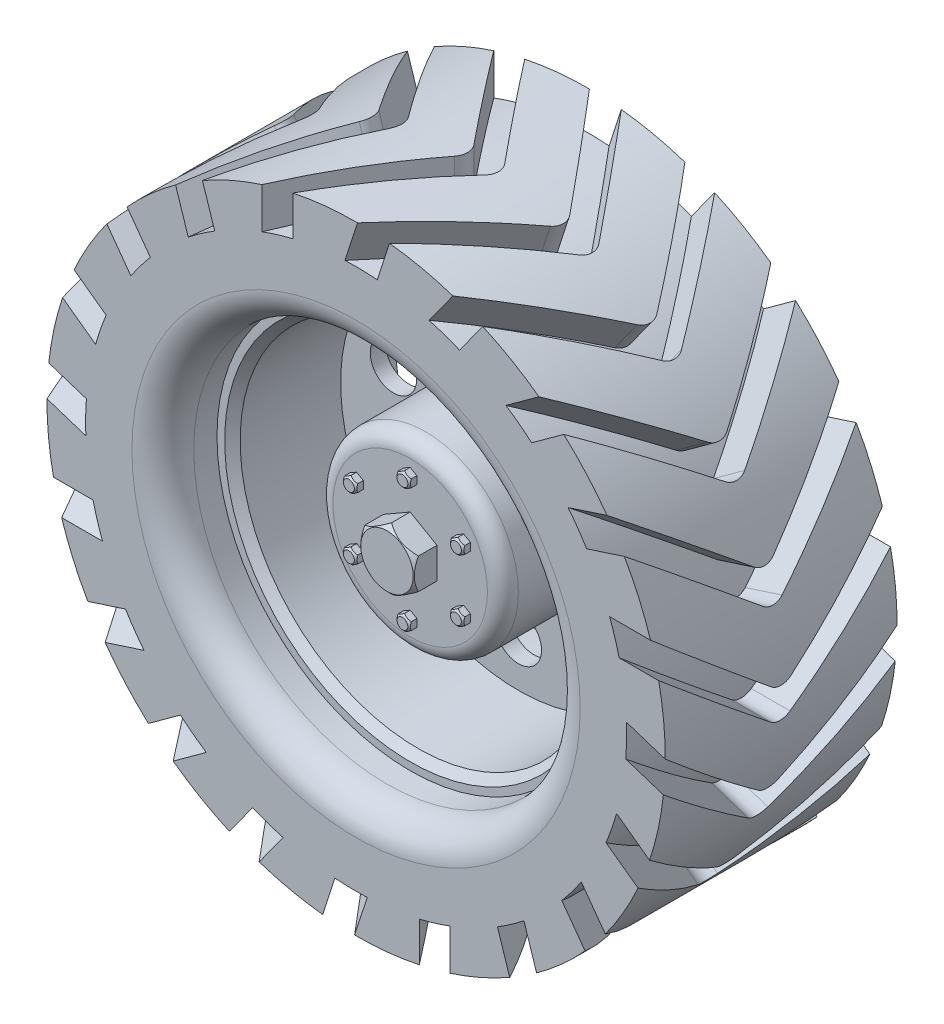
from build123d import *

# Parameters (mm, degrees)
SKETCH_1_R               = 125
EXTRUDE_1_DEPTH          = 40
SHELL_1_T                = -10
SKETCH_3_R               = 200
SKETCH_3_R_2             = 125
EXTRUDE_2_DEPTH          = 75
CHAMFER_1_SIZE           = 5
FILLET_2_R               = 20
SKETCH_4_R               = 60
EXTRUDE_3_DEPTH          = 70
FILLET_4_R               = 10
SKETCH_5_R               = 15
CUT_EXTRUDE_2_DEPTH      = 100
PATTERN_CIRCULAR_1_COUNT = 10
FILLET_5_R               = 5
SKETCH_7_R               = 20
EXTRUDE_5_DEPTH          = 15
CHAMFER_2_SIZE           = 3
CUT_EXTRUDE_START        = -15
CUT_EXTRUDE_3_DEPTH      = 15
SKETCH_9_R               = 5
EXTRUDE_6_DEPTH          = 5
CHAMFER_3_SIZE           = 1.5
PATTERN_CIRCULAR_2_COUNT = 6
CHAMFER_4_SIZE           = 1.5
CUT_EXTRUDE_START_2      = -5
CUT_EXTRUDE_4_DEPTH      = 5
PATTERN_CIRCULAR_4_COUNT = 6
CUT_EXTRUDE_5_REACH      = 545.714
CUT_EXTRUDE_5_END_RADIUS = 175
PATTERN_CIRCULAR_6_COUNT = 20
SKETCH_14_R              = 25
EXTRUDE_7_DEPTH          = 80


with BuildPart() as part:
    # 草圖1 → 填料-伸長1 (new, symmetric)
    with BuildSketch(Plane.XY):
        Circle(SKETCH_1_R)
    extrude(amount=EXTRUDE_1_DEPTH, both=True)

    # 薄殼1
    shell_1_openings = [part.faces().sort_by_distance(p)[0] for p in [
        (0, 0, 40),
    ]]
    offset(amount=SHELL_1_T, openings=shell_1_openings, kind=Kind.INTERSECTION)

    # 草圖3 → 填料-伸長2 (add, symmetric)
    with BuildSketch(Plane.XY):
        Circle(SKETCH_3_R)
        Circle(SKETCH_3_R_2, mode=Mode.SUBTRACT)
    extrude(amount=EXTRUDE_2_DEPTH, both=True)

    # 導角1
    chamfer_1_edges = [part.edges().sort_by_distance(p)[0] for p in [
        (-115, 0, 40),
    ]]
    chamfer(chamfer_1_edges, length=CHAMFER_1_SIZE)

    # 圓角2
    fillet_2_edges = [part.edges().sort_by_distance(p)[0] for p in [
        (-125, 0, 75),
    ]]
    fillet(fillet_2_edges, radius=FILLET_2_R)

    # 草圖4 → 填料-伸長3 (add)
    with BuildSketch(Plane.XY.offset(-30)):
        Circle(SKETCH_4_R)
    extrude(amount=EXTRUDE_3_DEPTH)

    # 圓角4
    fillet_4_edges = [part.edges().sort_by_distance(p)[0] for p in [
        (-60, 0, 40),
    ]]
    fillet(fillet_4_edges, radius=FILLET_4_R)

    # 草圖5 → 除料-伸長2 (cut)
    with BuildSketch(Plane.XY.offset(-30)):
        with Locations((0, 85)):
            Circle(SKETCH_5_R)
    cut_extrude_2 = extrude(amount=-CUT_EXTRUDE_2_DEPTH, mode=Mode.SUBTRACT)

    # 環狀複製排列1: 除料-伸長2 ×10 about axis
    pattern_circular_1_axis = Axis((0, 0, 0), (0, 0, 1))
    for i in range(1, PATTERN_CIRCULAR_1_COUNT):
        add(cut_extrude_2.rotate(pattern_circular_1_axis, i * 360 / PATTERN_CIRCULAR_1_COUNT), mode=Mode.SUBTRACT)

    # 圓角5
    fillet_5_edges = [part.edges().sort_by_distance(p)[0] for p in [
        (-60, 0, -30),
    ]]
    fillet(fillet_5_edges, radius=FILLET_5_R)

    # 草圖7 → 填料-伸長5 (add)
    with BuildSketch(Plane.XY.offset(40)):
        Circle(SKETCH_7_R)
    extrude(amount=EXTRUDE_5_DEPTH)

    # 導角2
    chamfer_2_edges = [part.edges().sort_by_distance(p)[0] for p in [
        (-20, 0, 55),
    ]]
    chamfer(chamfer_2_edges, length=CHAMFER_2_SIZE)

    # 草圖8 → 除料-伸長3 (cut)
    with BuildSketch(Plane.XY.offset(55).offset(CUT_EXTRUDE_START)):
        with BuildLine():
            Line((-17.320508076, 10), (0, 20))
            ThreePointArc((0, 20), (-10, 17.320508076), (-17.320508076, 10))
        make_face()
        with BuildLine():
            ThreePointArc((17.320508076, 10), (10, 17.320508076), (0, 20))
            Line((0, 20), (17.320508076, 10))
        make_face()
        with BuildLine():
            Line((-17.320508076, -10), (-17.320508076, 10))
            ThreePointArc((-17.320508076, 10), (-20, 0), (-17.320508076, -10))
        make_face()
        with BuildLine():
            Line((0, -20), (-17.320508076, -10))
            ThreePointArc((-17.320508076, -10), (-10, -17.320508076), (0, -20))
        make_face()
        with BuildLine():
            ThreePointArc((0, -20), (10, -17.320508076), (17.320508076, -10))
            Line((17.320508076, -10), (0, -20))
        make_face()
        with BuildLine():
            ThreePointArc((20, 0), (19.318516526, 5.176380902), (17.320508076, 10))
            Line((17.320508076, 10), (17.320508076, -10))
            ThreePointArc((17.320508076, -10), (19.318516526, -5.176380902), (20, 0))
        make_face()
    extrude(amount=CUT_EXTRUDE_3_DEPTH, mode=Mode.SUBTRACT)

    # 草圖9 → 填料-伸長6 (add)
    with BuildSketch(Plane.XY.offset(40)):
        with Locations((0, 40)):
            Circle(SKETCH_9_R)
    extrude_6 = extrude(amount=EXTRUDE_6_DEPTH)

    # 導角3
    chamfer_3_edges = [part.edges().sort_by_distance(p)[0] for p in [
        (-5, 40, 45),
    ]]
    chamfer(chamfer_3_edges, length=CHAMFER_3_SIZE)

    # 環狀複製排列2: 填料-伸長6 ×6 about axis
    pattern_circular_2_axis = Axis((0, 0, 0), (0, 0, 1))
    for i in range(1, PATTERN_CIRCULAR_2_COUNT):
        add(extrude_6.rotate(pattern_circular_2_axis, i * 360 / PATTERN_CIRCULAR_2_COUNT))

    # 導角4
    chamfer_4_edges = [part.edges().sort_by_distance(p)[0] for p in [
        (-37.141016151, 15.669872981, 45),
        (-32.141016151, -24.330127019, 45),
        (5, -40, 45),
        (37.141016151, -15.669872981, 45),
        (32.141016151, 24.330127019, 45),
    ]]
    chamfer(chamfer_4_edges, length=CHAMFER_4_SIZE)

    # 草圖10 → 除料-伸長4 (cut)
    with BuildSketch(Plane.XY.offset(45).offset(CUT_EXTRUDE_START_2)):
        with BuildLine():
            Line((-4.330127019, 42.5), (0, 45))
            ThreePointArc((0, 45), (-2.5, 44.330127019), (-4.330127019, 42.5))
        make_face()
        with BuildLine():
            ThreePointArc((4.330127019, 42.5), (2.5, 44.330127019), (0, 45))
            Line((0, 45), (4.330127019, 42.5))
        make_face()
        with BuildLine():
            Line((-4.330127019, 37.5), (-4.330127019, 42.5))
            ThreePointArc((-4.330127019, 42.5), (-5, 40), (-4.330127019, 37.5))
        make_face()
        with BuildLine():
            Line((0, 35), (-4.330127019, 37.5))
            ThreePointArc((-4.330127019, 37.5), (-2.5, 35.669872981), (0, 35))
        make_face()
        with BuildLine():
            ThreePointArc((0, 35), (2.5, 35.669872981), (4.330127019, 37.5))
            Line((4.330127019, 37.5), (0, 35))
        make_face()
        with BuildLine():
            ThreePointArc((5, 40), (4.829629131, 41.294095226), (4.330127019, 42.5))
            Line((4.330127019, 42.5), (4.330127019, 37.5))
            ThreePointArc((4.330127019, 37.5), (4.829629131, 38.705904774), (5, 40))
        make_face()
    cut_extrude_4 = extrude(amount=CUT_EXTRUDE_4_DEPTH, mode=Mode.SUBTRACT)

    # 環狀複製排列4: 除料-伸長4 ×6 about axis
    pattern_circular_4_axis = Axis((0, 0, 0), (0, 0, 1))
    for i in range(1, PATTERN_CIRCULAR_4_COUNT):
        add(cut_extrude_4.rotate(pattern_circular_4_axis, i * 360 / PATTERN_CIRCULAR_4_COUNT), mode=Mode.SUBTRACT)

    # 除料-伸長5: up to this cylinder (the profile starts outside it)
    cut_extrude_5_end = Plane(origin=(0, 0, -39.585833), z_dir=(0, 0, -1)) * Cylinder(CUT_EXTRUDE_5_END_RADIUS, 1442.428, mode=Mode.PRIVATE)
    # 草圖11 → 除料-伸長5 (cut, up to the surface)
    with BuildSketch(Plane(origin=(0, 300, 0), x_dir=(1, 0, 0), z_dir=(0, 1, 0)), mode=Mode.PRIVATE) as cut_extrude_5_sk1:
        with BuildLine():
            Line((-5.117227478, -6.302992351), (-60.890453209, -75))
            Line((-60.890453209, -75), (-40.890453209, -75))
            Line((-40.890453209, -75), (14.882772522, -6.302992351))
            ThreePointArc((14.882772522, -6.302992351), (17.119249648, 0), (14.882772522, 6.302992351))
            Line((14.882772522, 6.302992351), (-40.890453209, 75))
            Line((-40.890453209, 75), (-60.890453209, 75))
            Line((-60.890453209, 75), (-5.117227478, 6.302992351))
            ThreePointArc((-5.117227478, 6.302992351), (-2.880750352, 0), (-5.117227478, -6.302992351))
        make_face()
    cut_extrude_5_tool1 = extrude(cut_extrude_5_sk1.sketch, amount=-CUT_EXTRUDE_5_REACH, mode=Mode.PRIVATE) - cut_extrude_5_end
    cut_extrude_5 = cut_extrude_5_tool1.solids().sort_by_distance((-14.316439, 300, -39.585833))[0]
    add(cut_extrude_5, mode=Mode.SUBTRACT)

    # 環狀複製排列6: 除料-伸長5 ×20 about axis
    pattern_circular_6_axis = Axis((0, 0, 0), (0, 0, 1))
    for i in range(1, PATTERN_CIRCULAR_6_COUNT):
        add(cut_extrude_5.rotate(pattern_circular_6_axis, i * 360 / PATTERN_CIRCULAR_6_COUNT), mode=Mode.SUBTRACT)

    # 草圖14 → 填料-伸長7 (add)
    with BuildSketch(Plane(origin=(0, 0, -40), x_dir=(-1, 0, 0), z_dir=(0, 0, -1))):
        with Locations(Location((0, 0, 0), (0, 0, 180))):
            Circle(SKETCH_14_R)
    extrude(amount=EXTRUDE_7_DEPTH)


solid = part.part
